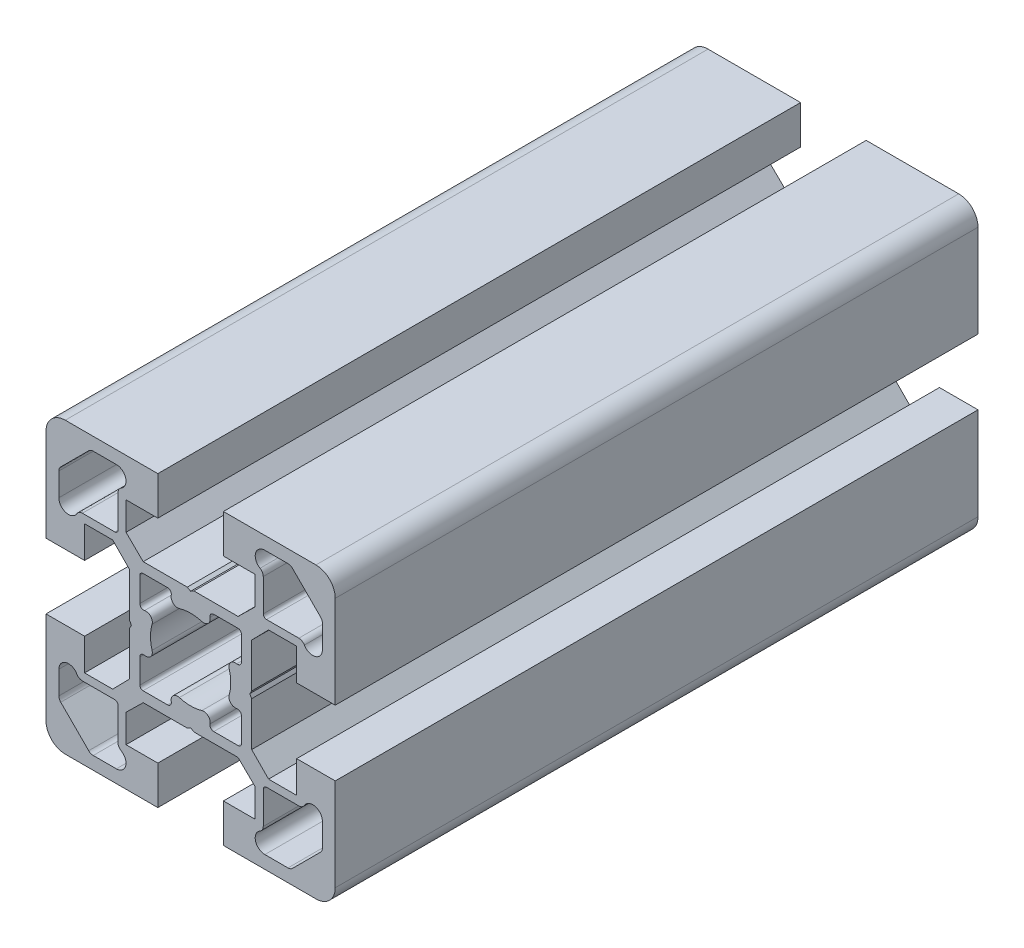
from build123d import *

# Parameters (mm, degrees)
BOSS_EXTRU_1_DEPTH = 100


with BuildPart() as part:
    # Esquisse1 → Boss.-Extru.1 (new body)
    with BuildSketch(Plane.XY):
        with BuildLine():
            Line((22.500000043, 5.099999967), (22.500000043, 19.499999968))
            ThreePointArc((22.500000043, 19.499999968), (21.621320369, 21.621320326), (19.500000002, 22.499999981))
            Line((19.500000002, 22.499999981), (5.100000002, 22.499999981))
            Line((5.100000002, 22.499999981), (5.100000002, 16.499999976))
            Line((5.100000002, 16.499999976), (10.050000002, 16.499999976))
            Line((10.050000002, 16.499999976), (10.050000002, 12.121320348))
            Line((10.050000002, 12.121320348), (7.378679628, 9.499999975))
            Line((7.378679628, 9.499999975), (0.51961526, 9.499999975))
            Line((0.51961526, 9.499999975), (1.4e-08, 9.199999973))
            Line((1.4e-08, 9.199999973), (-0.519615231, 9.499999975))
            Line((-0.519615231, 9.499999975), (-7.3786796, 9.499999975))
            Line((-7.3786796, 9.499999975), (-10.049999998, 12.121320324))
            Line((-10.049999998, 12.121320324), (-10.049999998, 16.499999952))
            Line((-10.049999998, 16.499999952), (-5.099999998, 16.499999952))
            Line((-5.099999998, 16.499999952), (-5.099999998, 22.499999958))
            Line((-5.099999998, 22.499999958), (-19.499999998, 22.499999958))
            ThreePointArc((-19.499999998, 22.499999958), (-21.621320357, 21.621320284), (-22.500000012, 19.499999917))
            Line((-22.500000012, 19.499999917), (-22.500000012, 5.099999917))
            Line((-22.500000012, 5.099999917), (-16.500000006, 5.099999917))
            Line((-16.500000006, 5.099999917), (-16.500000006, 10.049999917))
            Line((-16.500000006, 10.049999917), (-12.121320378, 10.049999917))
            Line((-12.121320378, 10.049999917), (-9.500000005, 7.378679543))
            Line((-9.500000005, 7.378679543), (-9.500000005, 0.519615174))
            Line((-9.500000005, 0.519615174), (-9.200000003, -7.1e-08))
            Line((-9.200000003, -7.1e-08), (-9.500000005, -0.519615317))
            Line((-9.500000005, -0.519615317), (-9.500000005, -7.378679686))
            Line((-9.500000005, -7.378679686), (-12.121320354, -10.050000083))
            Line((-12.121320354, -10.050000083), (-16.499999982, -10.050000083))
            Line((-16.499999982, -10.050000083), (-16.499999982, -5.100000083))
            Line((-16.499999982, -5.100000083), (-22.499999988, -5.100000083))
            Line((-22.499999988, -5.100000083), (-22.499999988, -19.500000083))
            ThreePointArc((-22.499999988, -19.500000083), (-21.621320314, -21.621320442), (-19.499999947, -22.500000097))
            Line((-19.499999947, -22.500000097), (-5.099999947, -22.500000097))
            Line((-5.099999947, -22.500000097), (-5.099999947, -16.500000091))
            Line((-5.099999947, -16.500000091), (-10.049999947, -16.500000091))
            Line((-10.049999947, -16.500000091), (-10.049999947, -12.121320464))
            Line((-10.049999947, -12.121320464), (-7.378679573, -9.500000091))
            Line((-7.378679573, -9.500000091), (-0.519615204, -9.500000091))
            Line((-0.519615204, -9.500000091), (4.1e-08, -9.200000089))
            Line((4.1e-08, -9.200000089), (0.519615287, -9.500000091))
            Line((0.519615287, -9.500000091), (7.378679655, -9.500000091))
            Line((7.378679655, -9.500000091), (10.050000053, -12.12132044))
            Line((10.050000053, -12.12132044), (10.050000053, -16.500000068))
            Line((10.050000053, -16.500000068), (5.100000053, -16.500000068))
            Line((5.100000053, -16.500000068), (5.100000053, -22.500000073))
            Line((5.100000053, -22.500000073), (19.500000053, -22.500000073))
            ThreePointArc((19.500000053, -22.500000073), (21.621320412, -21.621320399), (22.500000067, -19.500000033))
            Line((22.500000067, -19.500000033), (22.500000067, -5.100000033))
            Line((22.500000067, -5.100000033), (16.500000061, -5.100000033))
            Line((16.500000061, -5.100000033), (16.500000061, -10.050000033))
            Line((16.500000061, -10.050000033), (12.121320433, -10.050000033))
            Line((12.121320433, -10.050000033), (9.50000006, -7.378679659))
            Line((9.50000006, -7.378679659), (9.50000006, -0.51961529))
            Line((9.50000006, -0.51961529), (9.200000058, -4.4e-08))
            Line((9.200000058, -4.4e-08), (9.50000006, 0.519615201))
            Line((9.50000006, 0.519615201), (9.50000006, 7.37867957))
            Line((9.50000006, 7.37867957), (12.12132041, 10.049999967))
            Line((12.12132041, 10.049999967), (16.500000038, 10.049999967))
            Line((16.500000038, 10.049999967), (16.500000038, 5.099999967))
            Line((16.500000038, 5.099999967), (22.500000043, 5.099999967))
        make_face()
        with BuildLine():
            Line((15.855339158, -20.207106708), (20.207106825, -15.855339041))
            ThreePointArc((20.207106825, -15.855339041), (20.4238796, -15.530915671), (20.500000069, -15.148232209))
            Line((20.500000069, -15.148232209), (20.500000069, -11.54999993))
            ThreePointArc((20.500000069, -11.54999993), (19.388228621, -10.101111187), (17.700961947, -10.79999996))
            ThreePointArc((17.700961947, -10.79999996), (17.334936545, -11.166025343), (16.83493656, -11.299999931))
            Line((16.83493656, -11.299999931), (11.800000069, -11.299999931))
            ThreePointArc((11.800000069, -11.299999931), (11.446446677, -11.446446542), (11.300000069, -11.799999935))
            Line((11.300000069, -11.799999935), (11.300000069, -16.834936434))
            ThreePointArc((11.300000069, -16.834936434), (11.166025484, -17.334936416), (10.800000106, -17.700961817))
            ThreePointArc((10.800000106, -17.700961817), (10.101111348, -19.388228497), (11.550000101, -20.499999933))
            Line((11.550000101, -20.499999933), (15.14823238, -20.499999933))
            ThreePointArc((15.14823238, -20.499999933), (15.530915811, -20.423879462), (15.855339158, -20.207106708))
        make_face(mode=Mode.SUBTRACT)
        with BuildLine():
            Line((-20.499999933, -11.550000112), (-20.499999933, -15.148232391))
            ThreePointArc((-20.499999933, -15.148232391), (-20.423879462, -15.530915822), (-20.207106708, -15.855339169))
            Line((-20.207106708, -15.855339169), (-15.855339041, -20.207106836))
            ThreePointArc((-15.855339041, -20.207106836), (-15.530915692, -20.423879587), (-15.14823226, -20.500000055))
            Line((-15.14823226, -20.500000055), (-11.549999982, -20.500000055))
            ThreePointArc((-11.549999982, -20.500000055), (-10.101111238, -19.388228606), (-10.800000011, -17.700961932))
            ThreePointArc((-10.800000011, -17.700961932), (-11.166025359, -17.334936533), (-11.299999931, -16.834936571))
            Line((-11.299999931, -16.834936571), (-11.299999931, -11.80000008))
            ThreePointArc((-11.299999931, -11.80000008), (-11.446446542, -11.446446688), (-11.799999935, -11.30000008))
            Line((-11.799999935, -11.30000008), (-16.834936426, -11.30000008))
            ThreePointArc((-16.834936426, -11.30000008), (-17.334936412, -11.166025497), (-17.700961817, -10.800000117))
            ThreePointArc((-17.700961817, -10.800000117), (-19.388228497, -10.101111359), (-20.499999933, -11.550000112))
        make_face(mode=Mode.SUBTRACT)
        with BuildLine():
            Line((-15.85533915, 20.20710669), (-20.207106817, 15.855339024))
            ThreePointArc((-20.207106817, 15.855339024), (-20.423879568, 15.530915675), (-20.500000035, 15.148232242))
            Line((-20.500000035, 15.148232242), (-20.500000035, 11.549999964))
            ThreePointArc((-20.500000035, 11.549999964), (-19.388228587, 10.101111221), (-17.700961913, 10.799999993))
            ThreePointArc((-17.700961913, 10.799999993), (-17.334936511, 11.166025377), (-16.834936526, 11.299999965))
            Line((-16.834936526, 11.299999965), (-11.800000035, 11.299999965))
            ThreePointArc((-11.800000035, 11.299999965), (-11.446446643, 11.446446576), (-11.300000035, 11.799999969))
            Line((-11.300000035, 11.799999969), (-11.300000035, 16.834936459))
            ThreePointArc((-11.300000035, 16.834936459), (-11.16602545, 17.334936413), (-10.800000097, 17.7009618))
            ThreePointArc((-10.800000097, 17.7009618), (-10.10111134, 19.38822848), (-11.550000093, 20.499999915))
            Line((-11.550000093, 20.499999915), (-15.148232371, 20.499999915))
            ThreePointArc((-15.148232371, 20.499999915), (-15.530915803, 20.423879445), (-15.85533915, 20.20710669))
        make_face(mode=Mode.SUBTRACT)
        with BuildLine():
            Line((-3.600000106, 7.899999961), (-7.399999998, 7.899999961))
            ThreePointArc((-7.399999998, 7.899999961), (-7.753553388, 7.75355335), (-7.899999996, 7.399999959))
            Line((-7.899999996, 7.399999959), (-7.899999996, 3.600000067))
            ThreePointArc((-7.899999996, 3.600000067), (-7.676191867, 3.132581845), (-7.171734284, 3.013870341))
            ThreePointArc((-7.171734284, 3.013870341), (-6.226759165, 2.719151967), (-5.99823974, 1.75602385))
            ThreePointArc((-5.99823974, 1.75602385), (-6.249999979, -2.2e-08), (-5.998239727, -1.756023893))
            ThreePointArc((-5.998239727, -1.756023893), (-6.226759144, -2.719152011), (-7.171734261, -3.013870394))
            ThreePointArc((-7.171734261, -3.013870394), (-7.676191842, -3.132581902), (-7.899999967, -3.600000126))
            Line((-7.899999967, -3.600000126), (-7.899999967, -7.400000018))
            ThreePointArc((-7.899999967, -7.400000018), (-7.753553356, -7.753553408), (-7.399999965, -7.900000016))
            Line((-7.399999965, -7.900000016), (-3.600000073, -7.900000016))
            ThreePointArc((-3.600000073, -7.900000016), (-3.132581851, -7.676191887), (-3.013870347, -7.171734304))
            ThreePointArc((-3.013870347, -7.171734304), (-2.719151972, -6.226759185), (-1.756023856, -5.99823976))
            ThreePointArc((-1.756023856, -5.99823976), (2.8e-08, -6.25), (1.756023909, -5.998239744))
            ThreePointArc((1.756023909, -5.998239744), (2.719152028, -6.226759161), (3.013870411, -7.171734278))
            ThreePointArc((3.013870411, -7.171734278), (3.132581919, -7.676191859), (3.600000143, -7.899999984))
            Line((3.600000143, -7.899999984), (7.400000035, -7.899999984))
            ThreePointArc((7.400000035, -7.899999984), (7.75355342, -7.753553361), (7.900000016, -7.399999965))
            Line((7.900000016, -7.399999965), (7.900000016, -3.600000073))
            ThreePointArc((7.900000016, -3.600000073), (7.676191887, -3.132581851), (7.171734305, -3.013870347))
            ThreePointArc((7.171734305, -3.013870347), (6.226759185, -2.719151972), (5.99823976, -1.756023856))
            ThreePointArc((5.99823976, -1.756023856), (6.25, 2.8e-08), (5.998239744, 1.756023909))
            ThreePointArc((5.998239744, 1.756023909), (6.226759161, 2.719152028), (7.171734278, 3.013870411))
            ThreePointArc((7.171734278, 3.013870411), (7.676191859, 3.132581919), (7.899999984, 3.600000143))
            Line((7.899999984, 3.600000143), (7.899999984, 7.400000035))
            ThreePointArc((7.899999984, 7.400000035), (7.753553347, 7.753553403), (7.399999956, 7.899999985))
            Line((7.399999956, 7.899999985), (3.600000064, 7.899999985))
            ThreePointArc((3.600000064, 7.899999985), (3.132581842, 7.676191856), (3.013870338, 7.171734274))
            ThreePointArc((3.013870338, 7.171734274), (2.719151963, 6.226759154), (1.756023847, 5.998239729))
            ThreePointArc((1.756023847, 5.998239729), (-1.3e-08, 6.249999968), (-1.756023872, 5.998239721))
            ThreePointArc((-1.756023872, 5.998239721), (-2.719151991, 6.226759139), (-3.013870374, 7.171734255))
            ThreePointArc((-3.013870374, 7.171734255), (-3.132581882, 7.676191836), (-3.600000106, 7.899999961))
        make_face(mode=Mode.SUBTRACT)
        with BuildLine():
            Line((11.299999964, 16.83493656), (11.299999964, 11.800000069))
            ThreePointArc((11.299999964, 11.800000069), (11.446446575, 11.446446677), (11.799999969, 11.300000069))
            Line((11.799999969, 11.300000069), (16.834936459, 11.300000069))
            ThreePointArc((16.834936459, 11.300000069), (17.334936446, 11.166025486), (17.700961851, 10.800000106))
            ThreePointArc((17.700961851, 10.800000106), (19.388228531, 10.101111348), (20.499999967, 11.550000101))
            Line((20.499999967, 11.550000101), (20.499999967, 15.14823238))
            ThreePointArc((20.499999967, 15.14823238), (20.423879472, 15.530915844), (20.207106671, 15.855339203))
            Line((20.207106671, 15.855339203), (15.855339024, 20.207106851))
            ThreePointArc((15.855339024, 20.207106851), (15.530915675, 20.423879602), (15.148232242, 20.500000069))
            Line((15.148232242, 20.500000069), (11.549999964, 20.500000069))
            ThreePointArc((11.549999964, 20.500000069), (10.10111122, 19.388228621), (10.799999993, 17.700961947))
            ThreePointArc((10.799999993, 17.700961947), (11.166025377, 17.334936545), (11.299999964, 16.83493656))
        make_face(mode=Mode.SUBTRACT)
    extrude(amount=BOSS_EXTRU_1_DEPTH)


solid = part.part
